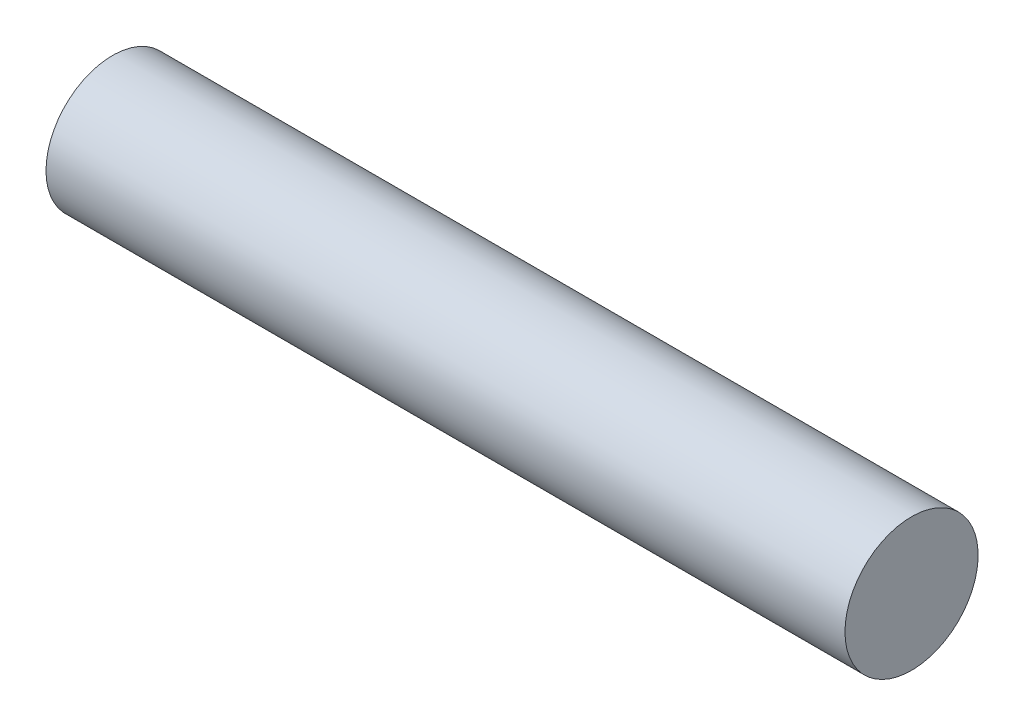
from build123d import *

# Parameters (mm, degrees)
SKETCH1_R           = 3.175
BOSS_EXTRUDE1_DEPTH = 38.1


with BuildPart() as part:
    # Sketch1 → Boss-Extrude1 (new body)
    with BuildSketch(Plane(origin=(0, 0, 0), x_dir=(0, 0, -1), z_dir=(1, 0, 0))):
        with Locations(Location((0, 0, 0), (0, 0, 180))):
            Circle(SKETCH1_R)
    extrude(amount=BOSS_EXTRUDE1_DEPTH)


solid = part.part
